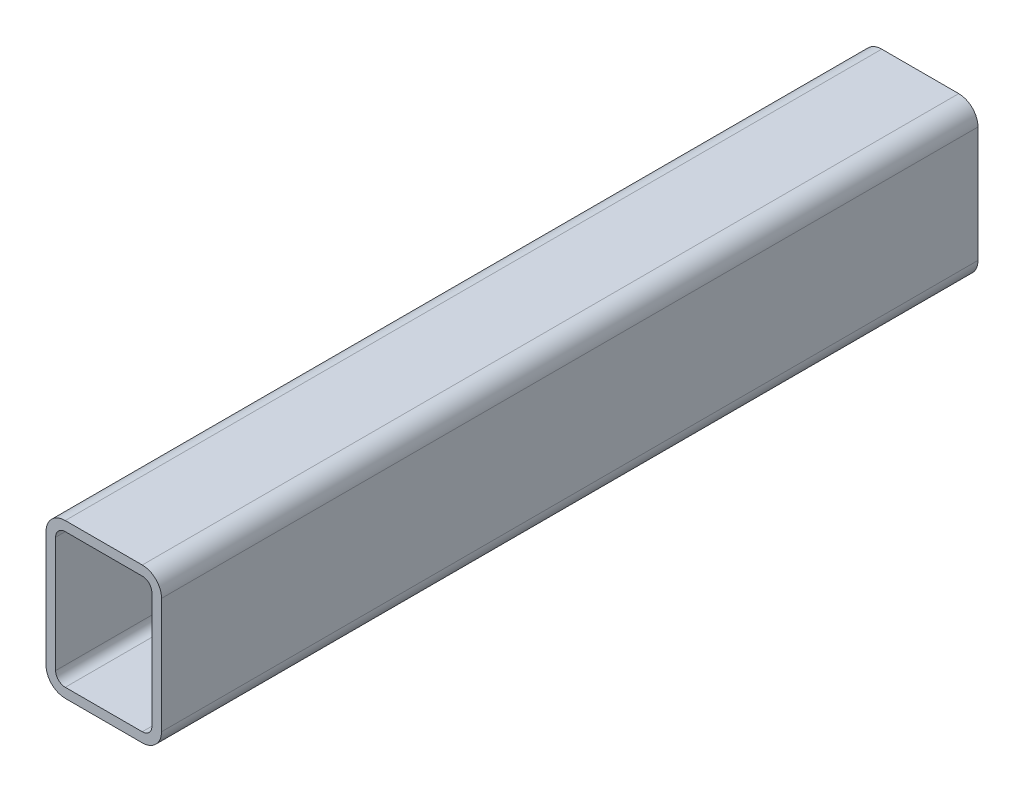
from build123d import *

# Parameters (mm, degrees)
EXTRUDE_1_DEPTH = 212


with BuildPart() as part:
    # Sketch 186 → 凸台-拉伸1 (new, symmetric)
    with BuildSketch(Plane.XY):
        with BuildLine():
            Line((-20, 40), (20, 40))
            ThreePointArc((20, 40), (27.071067812, 37.071067812), (30, 30))
            Line((30, 30), (30, -30))
            ThreePointArc((30, -30), (27.071067812, -37.071067812), (20, -40))
            Line((20, -40), (-20, -40))
            ThreePointArc((-20, -40), (-27.071067812, -37.071067812), (-30, -30))
            Line((-30, -30), (-30, 30))
            ThreePointArc((-30, 30), (-27.071067812, 37.071067812), (-20, 40))
        make_face()
        with BuildLine():
            Line((-20, 35), (20, 35))
            ThreePointArc((20, 35), (23.535533906, 33.535533906), (25, 30))
            Line((25, 30), (25, -30))
            ThreePointArc((25, -30), (23.535533906, -33.535533906), (20, -35))
            Line((20, -35), (-20, -35))
            ThreePointArc((-20, -35), (-23.535533906, -33.535533906), (-25, -30))
            Line((-25, -30), (-25, 30))
            ThreePointArc((-25, 30), (-23.535533906, 33.535533906), (-20, 35))
        make_face(mode=Mode.SUBTRACT)
    extrude(amount=EXTRUDE_1_DEPTH, both=True)


solid = part.part
